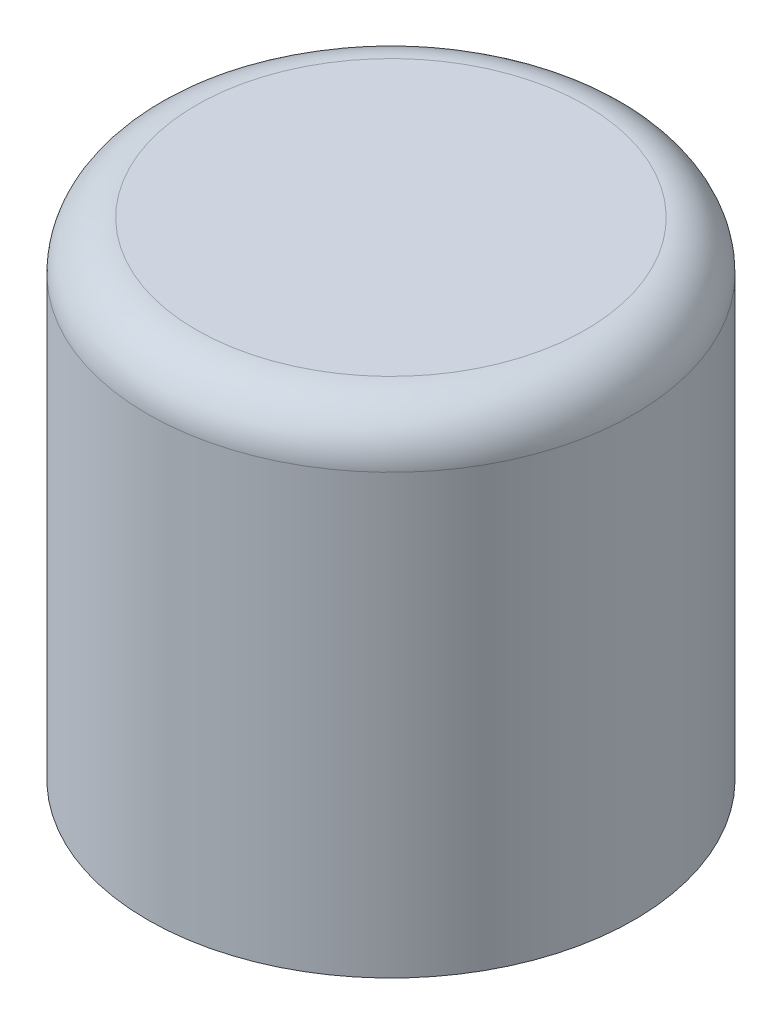
from build123d import *

# Parameters (mm, degrees)
SKETCH1_R           = 15
BOSS_EXTRUDE1_DEPTH = 30
FILLET1_R           = 3


with BuildPart() as part:
    # Sketch1 → Boss-Extrude1 (new body)
    with BuildSketch(Plane(origin=(0, 0, 0), x_dir=(1, 0, 0), z_dir=(0, 1, 0))):
        with Locations(Location((0, 0, 0), (0, 0, 270))):
            Circle(SKETCH1_R)
    extrude(amount=BOSS_EXTRUDE1_DEPTH)

    # Fillet1
    fillet1_edges = [part.edges().sort_by_distance(p)[0] for p in [
        (0, 30, -15),
    ]]
    fillet(fillet1_edges, radius=FILLET1_R)


solid = part.part
